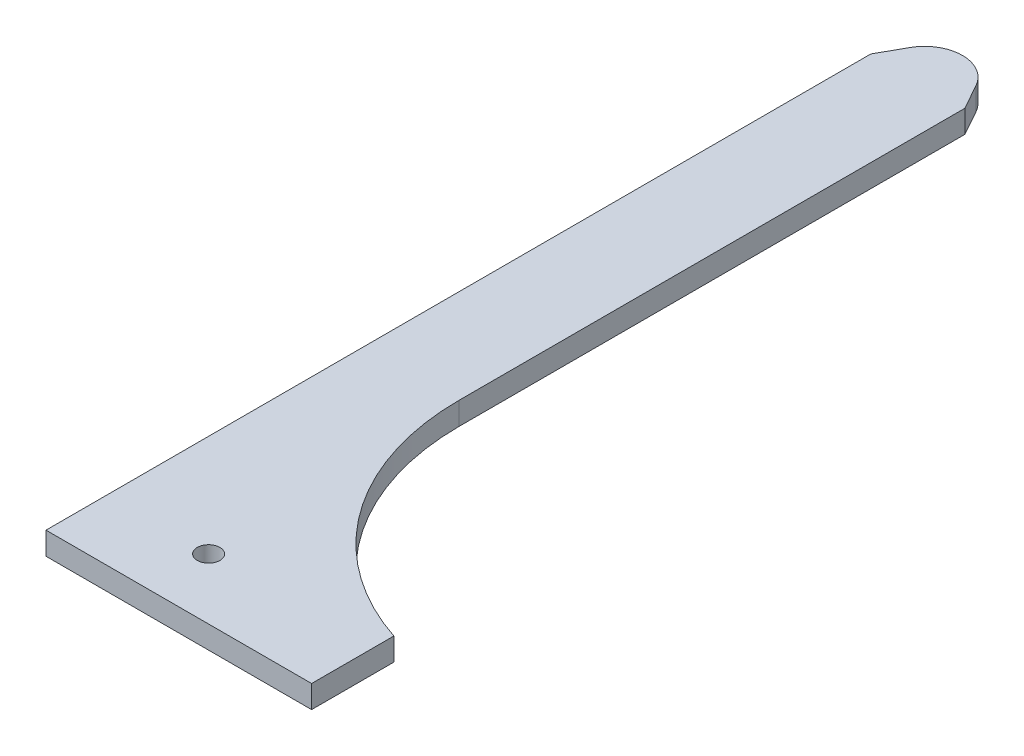
from build123d import *

# Parameters (mm, degrees)
SKETCH_1_R      = 1.5
EXTRUDE_1_DEPTH = 3
FILLET_4_R      = 5


with BuildPart() as part:
    # 草图1 → 凸台-拉伸1 (new body)
    with BuildSketch(Plane(origin=(0, 0, 0), x_dir=(1, 0, 0), z_dir=(0, 1, 0))):
        with BuildLine():
            Line((-33, 0), (-33, 67))
            Line((-33, 67), (-39.23, 78.185494034))
            Line((-39.23, 78.185494034), (-45.46, 67))
            Line((-45.46, 67), (-45.46, -42.262061372))
            Line((-45.46, -42.262061372), (-10.274300832, -42.262061372))
            Line((-10.274300832, -42.262061372), (-10.274300832, -31.359826887))
            ThreePointArc((-10.274300832, -31.359826887), (-26.721264261, -19.364246339), (-33, 0))
        make_face()
        with Locations(Location((-31.96, -34.222061372, 0), (0, 0, 270))):
            Circle(SKETCH_1_R, mode=Mode.SUBTRACT)
    extrude(amount=EXTRUDE_1_DEPTH)

    # 圆角4
    fillet_4_edges = [part.edges().sort_by_distance(p)[0] for p in [
        (-39.23, 1.5, -78.185494034),
    ]]
    fillet(fillet_4_edges, radius=FILLET_4_R)


solid = part.part
